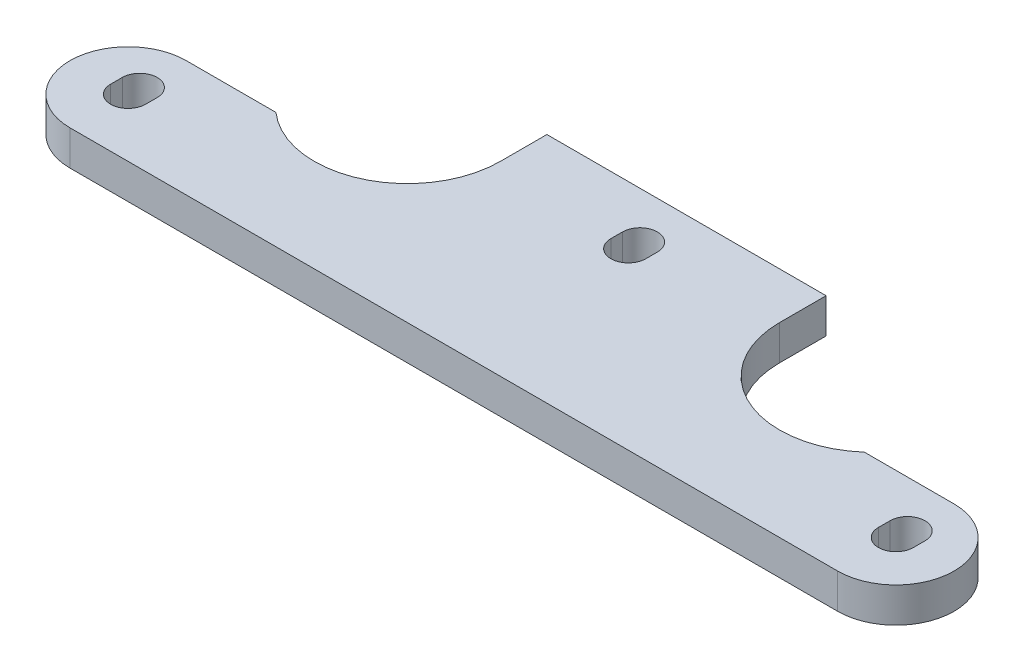
from build123d import *

# Parameters (mm, degrees)
BOSS_EXTRUDE1_DEPTH = 3
CUT_EXTRUDE1_DEPTH  = 44.0464865


with BuildPart() as part:
    # Sketch1 → Boss-Extrude1 (new body)
    with BuildSketch(Plane(origin=(0, 0, 0), x_dir=(1, 0, 0), z_dir=(0, 1, 0))):
        with BuildLine():
            Line((0, 0), (-33, 0))
            ThreePointArc((-33, 0), (-38, 5), (-33, 10))
            Line((-33, 10), (-25.291502622, 10))
            ThreePointArc((-25.291502622, 10), (-16.708497378, 8.708497378), (-12, 16))
            Line((-12, 16), (-12, 20))
            Line((-12, 20), (12, 20))
            Line((12, 20), (12, 16))
            ThreePointArc((12, 16), (16.708497378, 8.708497378), (25.291502622, 10))
            Line((25.291502622, 10), (33, 10))
            ThreePointArc((33, 10), (38, 5), (33, 0))
            Line((33, 0), (0, 0))
        make_face()
    extrude(amount=BOSS_EXTRUDE1_DEPTH)

    # Sketch2 → Cut-Extrude1 (cut, through all)
    with BuildSketch(Plane(origin=(0, 3, 0), x_dir=(1, 0, 0), z_dir=(0, 1, 0))):
        with BuildLine():
            Line((-34.5, 5), (-34.5, 6))
            ThreePointArc((-34.5, 6), (-33, 7.5), (-31.5, 6))
            Line((-31.5, 6), (-31.5, 5))
            ThreePointArc((-31.5, 5), (-33, 3.5), (-34.5, 5))
        make_face()
        with BuildLine():
            Line((31.5, 5), (31.5, 6))
            ThreePointArc((31.5, 6), (33, 7.5), (34.5, 6))
            Line((34.5, 6), (34.5, 5))
            ThreePointArc((34.5, 5), (33, 3.5), (31.5, 5))
        make_face()
        with BuildLine():
            Line((-1.5, 15), (-1.5, 16))
            ThreePointArc((-1.5, 16), (0, 17.5), (1.5, 16))
            Line((1.5, 16), (1.5, 15))
            ThreePointArc((1.5, 15), (0, 13.5), (-1.5, 15))
        make_face()
    extrude(amount=-CUT_EXTRUDE1_DEPTH, mode=Mode.SUBTRACT)


solid = part.part
